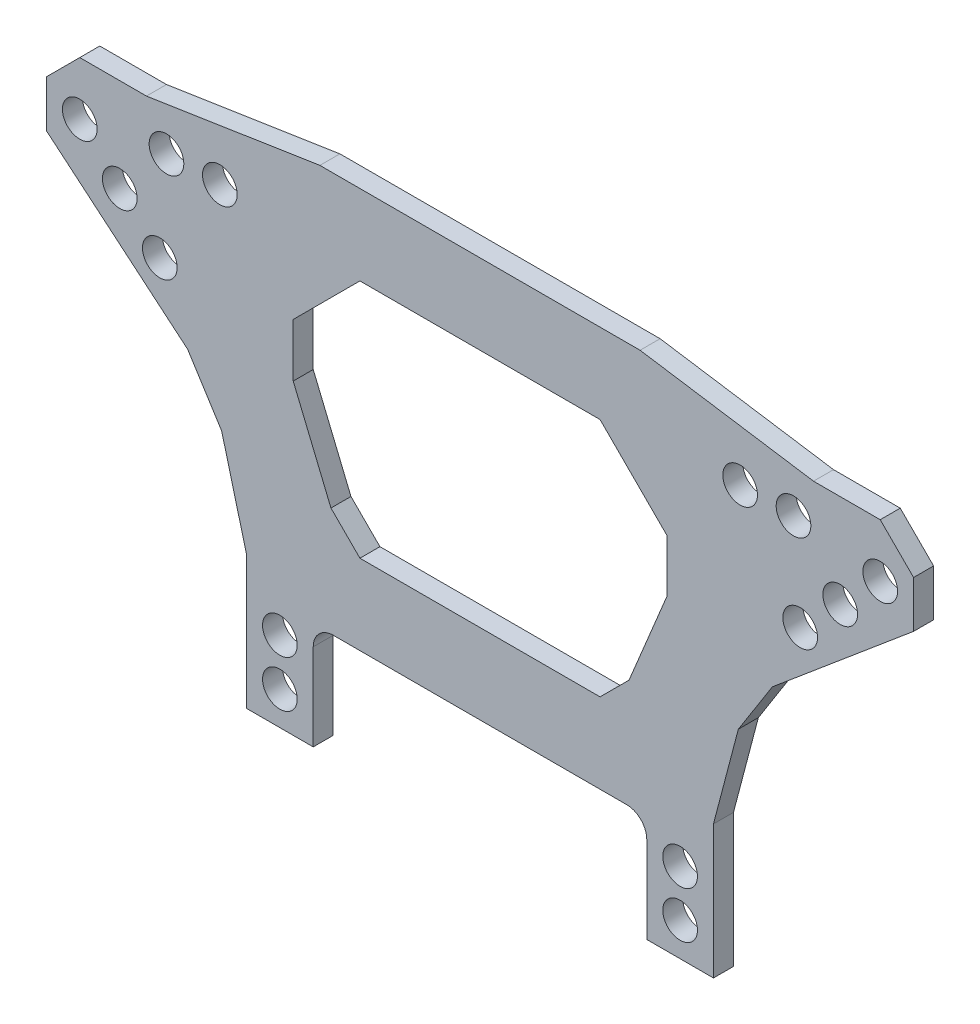
from build123d import *

# Parameters (mm, degrees)
SKETCH_1_W          = 10
SKETCH_1_H          = 20
SKETCH_1_R          = 2.6
EXTRUDE_1_DEPTH     = 3
CUT_EXTRUDE_1_DEPTH = 3
FILLET_2_R          = 3
CHAMFER_3_SIZE      = 5
CHAMFER_4_SIZE      = 5
CHAMFER_5_SIZE      = 5
SKETCH_4_R          = 2.6
CUT_EXTRUDE_2_DEPTH = 92.268833673
CHAMFER_8_SIZE      = 8
CHAMFER_9_SIZE      = 8


with BuildPart() as part:
    # 草图1 → 凸台-拉伸1 (new body)
    # profile 1 of 3: a face of its own
    with BuildSketch(Plane.XY):
        Polygon((-40, 27), (-35, 8), (-25, 8), (-25, 4), (25, 4), (25, 8), (35, 8), (40, 27), (65, 48), (65, 60), (50, 60), (24, 64), (-24, 64), (-50, 60), (-65, 60), (-65, 48), align=None)
    # profile 2 of 3: a face of its own
    with BuildSketch(Plane.XY):
        with Locations((-30, -2)):
            Rectangle(SKETCH_1_W, SKETCH_1_H)
        with Locations((-30, -7)):
            Circle(SKETCH_1_R, mode=Mode.SUBTRACT)
        with Locations((-30, 0)):
            Circle(SKETCH_1_R, mode=Mode.SUBTRACT)
    # profile 3 of 3: a face of its own
    with BuildSketch(Plane.XY):
        with Locations((30, -2)):
            Rectangle(SKETCH_1_W, SKETCH_1_H)
        with Locations((30, -7)):
            Circle(SKETCH_1_R, mode=Mode.SUBTRACT)
        with Locations((30, 0)):
            Circle(SKETCH_1_R, mode=Mode.SUBTRACT)
    extrude(amount=EXTRUDE_1_DEPTH)

    # 草图2 → 切除-拉伸1 (cut)
    with BuildSketch(Plane.XY.offset(3)):
        Polygon((-18, 52), (18, 52), (28, 42), (28, 26), (18, 16), (-18, 16), (-28, 26), (-28, 42), align=None)
    extrude(amount=-CUT_EXTRUDE_1_DEPTH, mode=Mode.SUBTRACT)

    # 圆角2
    fillet_2_edges = [part.edges().sort_by_distance(p)[0] for p in [
        (25, 4, 1.5),
        (-25, 4, 1.5),
    ]]
    fillet(fillet_2_edges, radius=FILLET_2_R)

    # 倒角3
    chamfer_3_edges = [part.edges().sort_by_distance(p)[0] for p in [
        (-40, 27, 1.5),
    ]]
    chamfer(chamfer_3_edges, length=CHAMFER_3_SIZE)

    # 倒角4
    chamfer_4_edges = [part.edges().sort_by_distance(p)[0] for p in [
        (40, 27, 1.5),
    ]]
    chamfer(chamfer_4_edges, length=CHAMFER_4_SIZE)

    # 倒角5
    chamfer_5_edges = [part.edges().sort_by_distance(p)[0] for p in [
        (-65, 60, 1.5),
        (65, 60, 1.5),
    ]]
    chamfer(chamfer_5_edges, length=CHAMFER_5_SIZE)

    # 草图4 → 切除-拉伸2 (cut, through all)
    with BuildSketch(Plane.XY.offset(3)):
        with Locations((-60, 52)):
            Circle(SKETCH_4_R)
        with Locations((-54, 46)):
            Circle(SKETCH_4_R)
        with Locations((-47, 54)):
            Circle(SKETCH_4_R)
        with Locations((-48, 40)):
            Circle(SKETCH_4_R)
        with Locations((-39, 54)):
            Circle(SKETCH_4_R)
    cut_extrude_2 = extrude(amount=-CUT_EXTRUDE_2_DEPTH, mode=Mode.SUBTRACT)

    # 镜向4: 切除-拉伸2 across plane
    add(cut_extrude_2.mirror(Plane(origin=(0, 0, 0), x_dir=(0, 0, 1), z_dir=(1, 0, 0))), mode=Mode.SUBTRACT)

    # 倒角8
    chamfer_8_edges = [part.edges().sort_by_distance(p)[0] for p in [
        (-28, 26, 1.5),
    ]]
    chamfer(chamfer_8_edges, length=CHAMFER_8_SIZE)

    # 倒角9
    chamfer_9_edges = [part.edges().sort_by_distance(p)[0] for p in [
        (28, 26, 1.5),
    ]]
    chamfer(chamfer_9_edges, length=CHAMFER_9_SIZE)


solid = part.part
